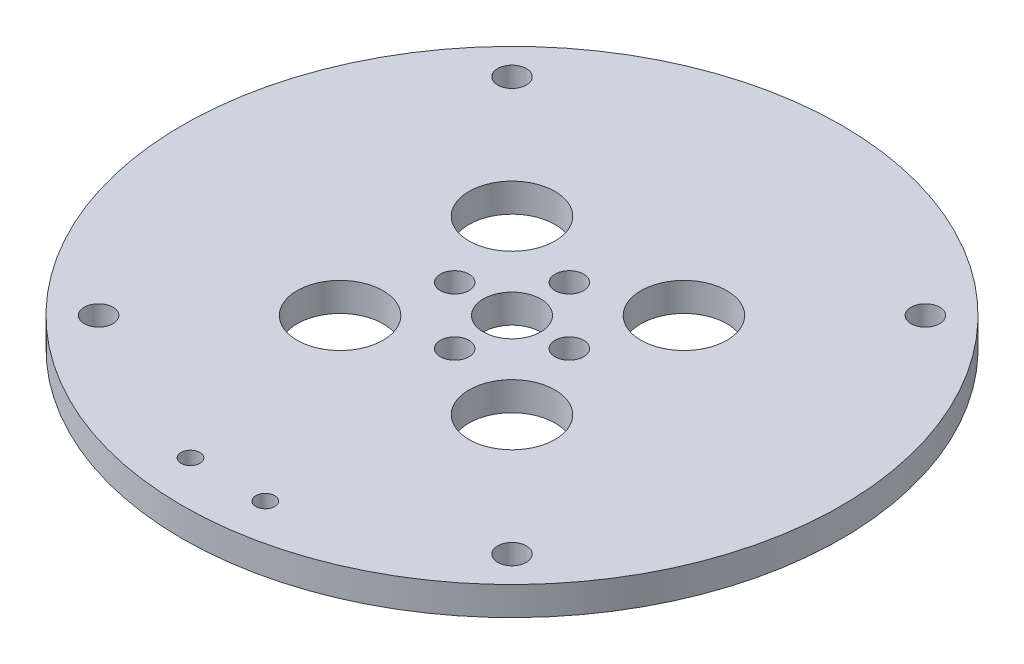
from build123d import *

# Parameters (mm, degrees)
SKETCH_1_R      = 57.5
SKETCH_1_R_2    = 2.5
SKETCH_1_R_3    = 5
SKETCH_1_R_4    = 7.5
SKETCH_1_R_5    = 1.65
EXTRUDE_1_DEPTH = 5


with BuildPart() as part:
    # ｽｹｯﾁ1 → ﾎﾞｽ - 押し出し1 (new body)
    with BuildSketch(Plane(origin=(0, 0, 0), x_dir=(1, 0, 0), z_dir=(0, 1, 0))):
        with Locations(Location((0, 0, 0), (0, 0, 270))):
            Circle(SKETCH_1_R)
        with Locations(Location((10, 0, 0), (0, 0, 270))):
            Circle(SKETCH_1_R_2, mode=Mode.SUBTRACT)
        with Locations(Location((0, 0, 0), (0, 0, 270))):
            Circle(SKETCH_1_R_3, mode=Mode.SUBTRACT)
        with Locations(Location((0, -10, 0), (0, 0, 270))):
            Circle(SKETCH_1_R_2, mode=Mode.SUBTRACT)
        with Locations(Location((-10, 0, 0), (0, 0, 270))):
            Circle(SKETCH_1_R_2, mode=Mode.SUBTRACT)
        with Locations(Location((0, 10, 0), (0, 0, 270))):
            Circle(SKETCH_1_R_2, mode=Mode.SUBTRACT)
        with Locations(Location((15, 15, 0), (0, 0, 270))):
            Circle(SKETCH_1_R_4, mode=Mode.SUBTRACT)
        with Locations(Location((15, -15, 0), (0, 0, 90))):
            Circle(SKETCH_1_R_4, mode=Mode.SUBTRACT)
        with Locations(Location((-15, -15, 0), (0, 0, 270))):
            Circle(SKETCH_1_R_4, mode=Mode.SUBTRACT)
        with Locations(Location((-15, 15, 0), (0, 0, 90))):
            Circle(SKETCH_1_R_4, mode=Mode.SUBTRACT)
        with Locations(Location((-6.526309611, -49.572243069, 0), (0, 0, 270))):
            Circle(SKETCH_1_R_5, mode=Mode.SUBTRACT)
        with Locations(Location((6.526309611, -49.572243069, 0), (0, 0, 90))):
            Circle(SKETCH_1_R_5, mode=Mode.SUBTRACT)
        with Locations(Location((-36.062445841, 36.062445841, 0), (0, 0, 270))):
            Circle(SKETCH_1_R_2, mode=Mode.SUBTRACT)
        with Locations(Location((36.062445841, 36.062445841, 0), (0, 0, 270))):
            Circle(SKETCH_1_R_2, mode=Mode.SUBTRACT)
        with Locations(Location((36.062445841, -36.062445841, 0), (0, 0, 270))):
            Circle(SKETCH_1_R_2, mode=Mode.SUBTRACT)
        with Locations(Location((-36.062445841, -36.062445841, 0), (0, 0, 270))):
            Circle(SKETCH_1_R_2, mode=Mode.SUBTRACT)
    extrude(amount=EXTRUDE_1_DEPTH)


solid = part.part
